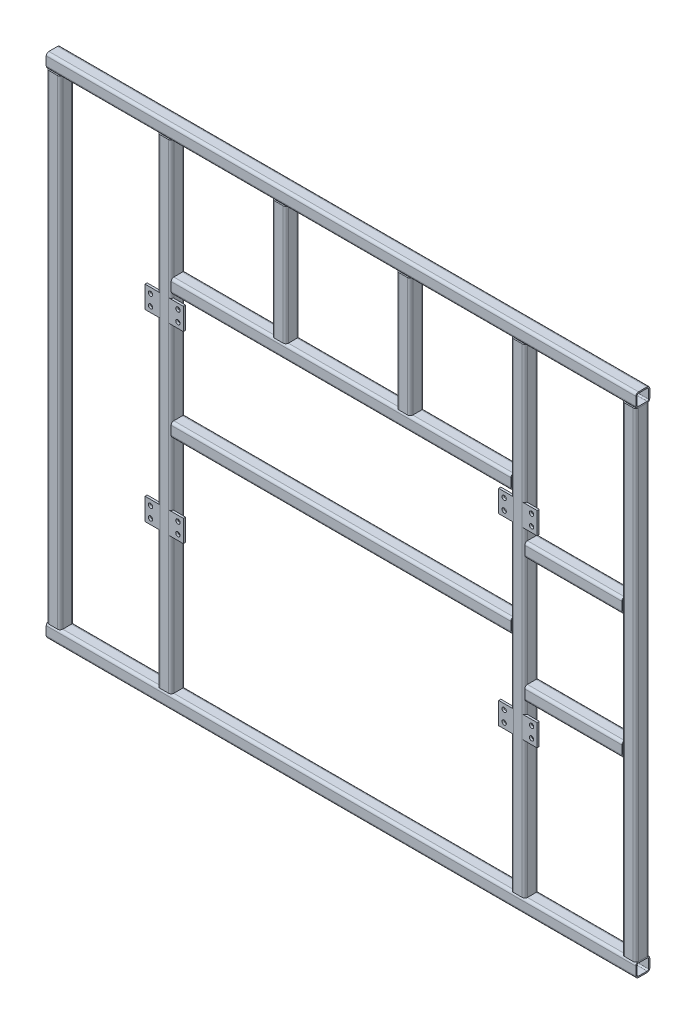
from build123d import *

# Parameters (mm, degrees)
RURA_CIENKO_CIENNA_KWADRATOWA_TS2X2X0_18_DEPTH      = 2125.4
RURA_CIENKO_CIENNA_KWADRATOWA_TS2X2X0_18_DEPTH_BACK = 25.4
RURA_CIENKO_CIENNA_KWADRATOWA_TS2X2X_2_DEPTH        = 2150.8
RURA_CIENKO_CIENNA_KWADRATOWA_TS2X2X_3_DEPTH        = 1292
RURA_CIENKO_CIENNA_KWADRATOWA_TS2X2X_5_DEPTH        = 1292
RURA_CIENKO_CIENNA_KWADRATOWA_TS2X2X_7_DEPTH        = 1802
RURA_CIENKO_CIENNA_KWADRATOWA_TS2X2X_9_DEPTH        = 1802
RURA_CIENKO_CIENNA_KWADRATOWA_TS2X2X_11_DEPTH       = 1802
RURA_CIENKO_CIENNA_KWADRATOWA_TS2X2X_14_DEPTH       = 1802
RURA_CIENKO_CIENNA_KWADRATOWA_TS2X2X_17_DEPTH       = 487
RURA_CIENKO_CIENNA_KWADRATOWA_TS2X2X_20_DEPTH       = 487
RURA_CIENKO_CIENNA_KWADRATOWA_TS2X2X_23_DEPTH       = 407
RURA_CIENKO_CIENNA_KWADRATOWA_TS2X2X_26_DEPTH       = 407
SZKIC16_W                                           = 140
SZKIC16_H                                           = 80
SZKIC16_R                                           = 8
DODANIE_WYCI_GNI_CIE1_DEPTH                         = 8
SZYK_LINIOWY1_COUNT                                 = 2
SZYK_LINIOWY1_PITCH                                 = 1290
SZYK_LINIOWY1_COUNT_DIR2                            = 2
SZYK_LINIOWY1_PITCH_DIR2                            = 670


with BuildPart() as part:
    # Sketch1 → Rura cienkościenna kwadratowa TS2X2X0.1875(1) (new, two sides: drawn at the far end of the back side and taken through both)
    with BuildSketch(Plane(origin=(0, 0, 0), x_dir=(0, 0, 1), z_dir=(1, 0, 0)).offset(-RURA_CIENKO_CIENNA_KWADRATOWA_TS2X2X0_18_DEPTH_BACK)):
        with BuildLine():
            Line((-15.875, -25.4), (15.875, -25.4))
            ThreePointArc((15.875, -25.4), (22.610192091, -22.610192091), (25.4, -15.875))
            Line((25.4, -15.875), (25.4, 15.875))
            ThreePointArc((25.4, 15.875), (22.610192091, 22.610192091), (15.875, 25.4))
            Line((15.875, 25.4), (-15.875, 25.4))
            ThreePointArc((-15.875, 25.4), (-22.610192091, 22.610192091), (-25.4, 15.875))
            Line((-25.4, 15.875), (-25.4, -15.875))
            ThreePointArc((-25.4, -15.875), (-22.610192091, -22.610192091), (-15.875, -25.4))
        make_face()
        with BuildLine():
            Line((-15.875, -20.6375), (15.875, -20.6375))
            ThreePointArc((15.875, -20.6375), (19.242596045, -19.242596045), (20.6375, -15.875))
            Line((20.6375, -15.875), (20.6375, 15.875))
            ThreePointArc((20.6375, 15.875), (19.242596045, 19.242596045), (15.875, 20.6375))
            Line((15.875, 20.6375), (-15.875, 20.6375))
            ThreePointArc((-15.875, 20.6375), (-19.242596045, 19.242596045), (-20.6375, 15.875))
            Line((-20.6375, 15.875), (-20.6375, -15.875))
            ThreePointArc((-20.6375, -15.875), (-19.242596045, -19.242596045), (-15.875, -20.6375))
        make_face(mode=Mode.SUBTRACT)
    extrude(amount=RURA_CIENKO_CIENNA_KWADRATOWA_TS2X2X0_18_DEPTH + RURA_CIENKO_CIENNA_KWADRATOWA_TS2X2X0_18_DEPTH_BACK)


with BuildPart() as body_2:
    # Sketch1 on segment 2 (carried to segment 2) → Rura cienko_cienna kwadratowa TS2X2X 2 (new body)
    with BuildSketch(Plane(origin=(-25.4, 1800, 0), x_dir=(0, 0, 1), z_dir=(1, 0, 0))):
        with BuildLine():
            Line((-15.875, -25.4), (15.875, -25.4))
            ThreePointArc((15.875, -25.4), (22.610192091, -22.610192091), (25.4, -15.875))
            Line((25.4, -15.875), (25.4, 15.875))
            ThreePointArc((25.4, 15.875), (22.610192091, 22.610192091), (15.875, 25.4))
            Line((15.875, 25.4), (-15.875, 25.4))
            ThreePointArc((-15.875, 25.4), (-22.610192091, 22.610192091), (-25.4, 15.875))
            Line((-25.4, 15.875), (-25.4, -15.875))
            ThreePointArc((-25.4, -15.875), (-22.610192091, -22.610192091), (-15.875, -25.4))
        make_face()
        with BuildLine():
            Line((-15.875, -20.6375), (15.875, -20.6375))
            ThreePointArc((15.875, -20.6375), (19.242596045, -19.242596045), (20.6375, -15.875))
            Line((20.6375, -15.875), (20.6375, 15.875))
            ThreePointArc((20.6375, 15.875), (19.242596045, 19.242596045), (15.875, 20.6375))
            Line((15.875, 20.6375), (-15.875, 20.6375))
            ThreePointArc((-15.875, 20.6375), (-19.242596045, 19.242596045), (-20.6375, 15.875))
            Line((-20.6375, 15.875), (-20.6375, -15.875))
            ThreePointArc((-20.6375, -15.875), (-19.242596045, -19.242596045), (-15.875, -20.6375))
        make_face(mode=Mode.SUBTRACT)
    extrude(amount=RURA_CIENKO_CIENNA_KWADRATOWA_TS2X2X_2_DEPTH)


with BuildPart() as body_3:
    # Sketch1 on segment 3 (carried to segment 3) → Rura cienko_cienna kwadratowa TS2X2X 3 (new body)
    with BuildSketch(Plane(origin=(404, 1315, 0), x_dir=(0, 0, 1), z_dir=(1, 0, 0))):
        with BuildLine():
            Line((-15.875, -25.4), (15.875, -25.4))
            ThreePointArc((15.875, -25.4), (22.610192091, -22.610192091), (25.4, -15.875))
            Line((25.4, -15.875), (25.4, 15.875))
            ThreePointArc((25.4, 15.875), (22.610192091, 22.610192091), (15.875, 25.4))
            Line((15.875, 25.4), (-15.875, 25.4))
            ThreePointArc((-15.875, 25.4), (-22.610192091, 22.610192091), (-25.4, 15.875))
            Line((-25.4, 15.875), (-25.4, -15.875))
            ThreePointArc((-25.4, -15.875), (-22.610192091, -22.610192091), (-15.875, -25.4))
        make_face()
        with BuildLine():
            Line((-15.875, -20.6375), (15.875, -20.6375))
            ThreePointArc((15.875, -20.6375), (19.242596045, -19.242596045), (20.6375, -15.875))
            Line((20.6375, -15.875), (20.6375, 15.875))
            ThreePointArc((20.6375, 15.875), (19.242596045, 19.242596045), (15.875, 20.6375))
            Line((15.875, 20.6375), (-15.875, 20.6375))
            ThreePointArc((-15.875, 20.6375), (-19.242596045, 19.242596045), (-20.6375, 15.875))
            Line((-20.6375, 15.875), (-20.6375, -15.875))
            ThreePointArc((-20.6375, -15.875), (-19.242596045, -19.242596045), (-15.875, -20.6375))
        make_face(mode=Mode.SUBTRACT)
    extrude(amount=RURA_CIENKO_CIENNA_KWADRATOWA_TS2X2X_3_DEPTH)

    # Rura cienko_cienna kwadratowa TS2X2X 3 e
    split(bisect_by=Plane(origin=(430.4, 1315, 0), x_dir=(0, 1, 0), z_dir=(1, 0, 0)), keep=Keep.TOP)

    # Rura cienko_cienna kwadratowa TS2X2X 4
    split(bisect_by=Plane(origin=(1669.6, 1315, 0), x_dir=(0, -1, 0), z_dir=(-1, 0, 0)), keep=Keep.TOP)


with BuildPart() as body_4:
    # Sketch1 on segment 4 (carried to segment 4) → Rura cienko_cienna kwadratowa TS2X2X 5 (new body)
    with BuildSketch(Plane(origin=(404, 861, 0), x_dir=(0, 0, 1), z_dir=(1, 0, 0))):
        with BuildLine():
            Line((-15.875, -25.4), (15.875, -25.4))
            ThreePointArc((15.875, -25.4), (22.610192091, -22.610192091), (25.4, -15.875))
            Line((25.4, -15.875), (25.4, 15.875))
            ThreePointArc((25.4, 15.875), (22.610192091, 22.610192091), (15.875, 25.4))
            Line((15.875, 25.4), (-15.875, 25.4))
            ThreePointArc((-15.875, 25.4), (-22.610192091, 22.610192091), (-25.4, 15.875))
            Line((-25.4, 15.875), (-25.4, -15.875))
            ThreePointArc((-25.4, -15.875), (-22.610192091, -22.610192091), (-15.875, -25.4))
        make_face()
        with BuildLine():
            Line((-15.875, -20.6375), (15.875, -20.6375))
            ThreePointArc((15.875, -20.6375), (19.242596045, -19.242596045), (20.6375, -15.875))
            Line((20.6375, -15.875), (20.6375, 15.875))
            ThreePointArc((20.6375, 15.875), (19.242596045, 19.242596045), (15.875, 20.6375))
            Line((15.875, 20.6375), (-15.875, 20.6375))
            ThreePointArc((-15.875, 20.6375), (-19.242596045, 19.242596045), (-20.6375, 15.875))
            Line((-20.6375, 15.875), (-20.6375, -15.875))
            ThreePointArc((-20.6375, -15.875), (-19.242596045, -19.242596045), (-15.875, -20.6375))
        make_face(mode=Mode.SUBTRACT)
    extrude(amount=RURA_CIENKO_CIENNA_KWADRATOWA_TS2X2X_5_DEPTH)

    # Rura cienko_cienna kwadratowa TS2X2X 5 e
    split(bisect_by=Plane(origin=(430.4, 861, 0), x_dir=(0, 1, 0), z_dir=(1, 0, 0)), keep=Keep.TOP)

    # Rura cienko_cienna kwadratowa TS2X2X 6
    split(bisect_by=Plane(origin=(1669.6, 861, 0), x_dir=(0, -1, 0), z_dir=(-1, 0, 0)), keep=Keep.TOP)


with BuildPart() as body_5:
    # Sketch1 on segment 5 (carried to segment 5) → Rura cienko_cienna kwadratowa TS2X2X 7 (new body)
    with BuildSketch(Plane.ZX.offset(-1)):
        with BuildLine():
            Line((-15.875, -25.4), (15.875, -25.4))
            ThreePointArc((15.875, -25.4), (22.610192091, -22.610192091), (25.4, -15.875))
            Line((25.4, -15.875), (25.4, 15.875))
            ThreePointArc((25.4, 15.875), (22.610192091, 22.610192091), (15.875, 25.4))
            Line((15.875, 25.4), (-15.875, 25.4))
            ThreePointArc((-15.875, 25.4), (-22.610192091, 22.610192091), (-25.4, 15.875))
            Line((-25.4, 15.875), (-25.4, -15.875))
            ThreePointArc((-25.4, -15.875), (-22.610192091, -22.610192091), (-15.875, -25.4))
        make_face()
        with BuildLine():
            Line((-15.875, -20.6375), (15.875, -20.6375))
            ThreePointArc((15.875, -20.6375), (19.242596045, -19.242596045), (20.6375, -15.875))
            Line((20.6375, -15.875), (20.6375, 15.875))
            ThreePointArc((20.6375, 15.875), (19.242596045, 19.242596045), (15.875, 20.6375))
            Line((15.875, 20.6375), (-15.875, 20.6375))
            ThreePointArc((-15.875, 20.6375), (-19.242596045, 19.242596045), (-20.6375, 15.875))
            Line((-20.6375, 15.875), (-20.6375, -15.875))
            ThreePointArc((-20.6375, -15.875), (-19.242596045, -19.242596045), (-15.875, -20.6375))
        make_face(mode=Mode.SUBTRACT)
    extrude(amount=RURA_CIENKO_CIENNA_KWADRATOWA_TS2X2X_7_DEPTH)

    # Rura cienko_cienna kwadratowa TS2X2X 7 e
    split(bisect_by=Plane(origin=(0, 25.4, 0), x_dir=(-1, 0, 0), z_dir=(0, 1, 0)), keep=Keep.TOP)

    # Rura cienko_cienna kwadratowa TS2X2X 8
    split(bisect_by=Plane.XZ.offset(-1774.6), keep=Keep.TOP)


with BuildPart() as body_6:
    # Sketch1 on segment 6 (carried to segment 6) → Rura cienko_cienna kwadratowa TS2X2X 9 (new body)
    with BuildSketch(Plane(origin=(405, 1801, 0), x_dir=(0, 0, 1), z_dir=(0, -1, 0))):
        with BuildLine():
            Line((-15.875, -25.4), (15.875, -25.4))
            ThreePointArc((15.875, -25.4), (22.610192091, -22.610192091), (25.4, -15.875))
            Line((25.4, -15.875), (25.4, 15.875))
            ThreePointArc((25.4, 15.875), (22.610192091, 22.610192091), (15.875, 25.4))
            Line((15.875, 25.4), (-15.875, 25.4))
            ThreePointArc((-15.875, 25.4), (-22.610192091, 22.610192091), (-25.4, 15.875))
            Line((-25.4, 15.875), (-25.4, -15.875))
            ThreePointArc((-25.4, -15.875), (-22.610192091, -22.610192091), (-15.875, -25.4))
        make_face()
        with BuildLine():
            Line((-15.875, -20.6375), (15.875, -20.6375))
            ThreePointArc((15.875, -20.6375), (19.242596045, -19.242596045), (20.6375, -15.875))
            Line((20.6375, -15.875), (20.6375, 15.875))
            ThreePointArc((20.6375, 15.875), (19.242596045, 19.242596045), (15.875, 20.6375))
            Line((15.875, 20.6375), (-15.875, 20.6375))
            ThreePointArc((-15.875, 20.6375), (-19.242596045, 19.242596045), (-20.6375, 15.875))
            Line((-20.6375, 15.875), (-20.6375, -15.875))
            ThreePointArc((-20.6375, -15.875), (-19.242596045, -19.242596045), (-15.875, -20.6375))
        make_face(mode=Mode.SUBTRACT)
    extrude(amount=RURA_CIENKO_CIENNA_KWADRATOWA_TS2X2X_9_DEPTH)

    # Rura cienko_cienna kwadratowa TS2X2X 9 e
    split(bisect_by=Plane(origin=(405, 1774.6, 0), x_dir=(1, 0, 0), z_dir=(0, -1, 0)), keep=Keep.TOP)

    # Rura cienko_cienna kwadratowa TS2X2X 10
    split(bisect_by=Plane(origin=(405, 25.4, 0), x_dir=(-1, 0, 0), z_dir=(0, 1, 0)), keep=Keep.TOP)


with BuildPart() as body_7:
    # Sketch1 on segment 7 (carried to segment 7) → Rura cienko_cienna kwadratowa TS2X2X 11 (new body)
    with BuildSketch(Plane(origin=(1695, 1801, 0), x_dir=(0, 0, 1), z_dir=(0, -1, 0))):
        with BuildLine():
            Line((-15.875, -25.4), (15.875, -25.4))
            ThreePointArc((15.875, -25.4), (22.610192091, -22.610192091), (25.4, -15.875))
            Line((25.4, -15.875), (25.4, 15.875))
            ThreePointArc((25.4, 15.875), (22.610192091, 22.610192091), (15.875, 25.4))
            Line((15.875, 25.4), (-15.875, 25.4))
            ThreePointArc((-15.875, 25.4), (-22.610192091, 22.610192091), (-25.4, 15.875))
            Line((-25.4, 15.875), (-25.4, -15.875))
            ThreePointArc((-25.4, -15.875), (-22.610192091, -22.610192091), (-15.875, -25.4))
        make_face()
        with BuildLine():
            Line((-15.875, -20.6375), (15.875, -20.6375))
            ThreePointArc((15.875, -20.6375), (19.242596045, -19.242596045), (20.6375, -15.875))
            Line((20.6375, -15.875), (20.6375, 15.875))
            ThreePointArc((20.6375, 15.875), (19.242596045, 19.242596045), (15.875, 20.6375))
            Line((15.875, 20.6375), (-15.875, 20.6375))
            ThreePointArc((-15.875, 20.6375), (-19.242596045, 19.242596045), (-20.6375, 15.875))
            Line((-20.6375, 15.875), (-20.6375, -15.875))
            ThreePointArc((-20.6375, -15.875), (-19.242596045, -19.242596045), (-15.875, -20.6375))
        make_face(mode=Mode.SUBTRACT)
    extrude(amount=RURA_CIENKO_CIENNA_KWADRATOWA_TS2X2X_11_DEPTH)

    # Rura cienko_cienna kwadratowa TS2X2X 12
    split(bisect_by=Plane(origin=(1695, 1774.6, 0), x_dir=(1, 0, 0), z_dir=(0, -1, 0)), keep=Keep.TOP)

    # Rura cienko_cienna kwadratowa TS2X2X 13
    split(bisect_by=Plane(origin=(1695, 25.4, 0), x_dir=(-1, 0, 0), z_dir=(0, 1, 0)), keep=Keep.TOP)


with BuildPart() as body_8:
    # Sketch1 on segment 8 (carried to segment 8) → Rura cienko_cienna kwadratowa TS2X2X 14 (new body)
    with BuildSketch(Plane(origin=(2100, -1, 0), x_dir=(0, 0, 1), z_dir=(0, 1, 0))):
        with BuildLine():
            Line((-15.875, -25.4), (15.875, -25.4))
            ThreePointArc((15.875, -25.4), (22.610192091, -22.610192091), (25.4, -15.875))
            Line((25.4, -15.875), (25.4, 15.875))
            ThreePointArc((25.4, 15.875), (22.610192091, 22.610192091), (15.875, 25.4))
            Line((15.875, 25.4), (-15.875, 25.4))
            ThreePointArc((-15.875, 25.4), (-22.610192091, 22.610192091), (-25.4, 15.875))
            Line((-25.4, 15.875), (-25.4, -15.875))
            ThreePointArc((-25.4, -15.875), (-22.610192091, -22.610192091), (-15.875, -25.4))
        make_face()
        with BuildLine():
            Line((-15.875, -20.6375), (15.875, -20.6375))
            ThreePointArc((15.875, -20.6375), (19.242596045, -19.242596045), (20.6375, -15.875))
            Line((20.6375, -15.875), (20.6375, 15.875))
            ThreePointArc((20.6375, 15.875), (19.242596045, 19.242596045), (15.875, 20.6375))
            Line((15.875, 20.6375), (-15.875, 20.6375))
            ThreePointArc((-15.875, 20.6375), (-19.242596045, 19.242596045), (-20.6375, 15.875))
            Line((-20.6375, 15.875), (-20.6375, -15.875))
            ThreePointArc((-20.6375, -15.875), (-19.242596045, -19.242596045), (-15.875, -20.6375))
        make_face(mode=Mode.SUBTRACT)
    extrude(amount=RURA_CIENKO_CIENNA_KWADRATOWA_TS2X2X_14_DEPTH)

    # Rura cienko_cienna kwadratowa TS2X2X 15
    split(bisect_by=Plane(origin=(2100, 25.4, 0), x_dir=(-1, 0, 0), z_dir=(0, 1, 0)), keep=Keep.TOP)

    # Rura cienko_cienna kwadratowa TS2X2X 16
    split(bisect_by=Plane(origin=(2100, 1774.6, 0), x_dir=(1, 0, 0), z_dir=(0, -1, 0)), keep=Keep.TOP)


with BuildPart() as body_9:
    # Sketch1 on segment 9 (carried to segment 9) → Rura cienko_cienna kwadratowa TS2X2X 17 (new body)
    with BuildSketch(Plane(origin=(823, 1314, 0), x_dir=(-1, 0, 0), z_dir=(0, 1, 0))):
        with BuildLine():
            Line((-15.875, -25.4), (15.875, -25.4))
            ThreePointArc((15.875, -25.4), (22.610192091, -22.610192091), (25.4, -15.875))
            Line((25.4, -15.875), (25.4, 15.875))
            ThreePointArc((25.4, 15.875), (22.610192091, 22.610192091), (15.875, 25.4))
            Line((15.875, 25.4), (-15.875, 25.4))
            ThreePointArc((-15.875, 25.4), (-22.610192091, 22.610192091), (-25.4, 15.875))
            Line((-25.4, 15.875), (-25.4, -15.875))
            ThreePointArc((-25.4, -15.875), (-22.610192091, -22.610192091), (-15.875, -25.4))
        make_face()
        with BuildLine():
            Line((-15.875, -20.6375), (15.875, -20.6375))
            ThreePointArc((15.875, -20.6375), (19.242596045, -19.242596045), (20.6375, -15.875))
            Line((20.6375, -15.875), (20.6375, 15.875))
            ThreePointArc((20.6375, 15.875), (19.242596045, 19.242596045), (15.875, 20.6375))
            Line((15.875, 20.6375), (-15.875, 20.6375))
            ThreePointArc((-15.875, 20.6375), (-19.242596045, 19.242596045), (-20.6375, 15.875))
            Line((-20.6375, 15.875), (-20.6375, -15.875))
            ThreePointArc((-20.6375, -15.875), (-19.242596045, -19.242596045), (-15.875, -20.6375))
        make_face(mode=Mode.SUBTRACT)
    extrude(amount=RURA_CIENKO_CIENNA_KWADRATOWA_TS2X2X_17_DEPTH)

    # Rura cienko_cienna kwadratowa TS2X2X 18
    split(bisect_by=Plane(origin=(823, 1340.4, 0), x_dir=(-1, 0, 0), z_dir=(0, 1, 0)), keep=Keep.TOP)

    # Rura cienko_cienna kwadratowa TS2X2X 19
    split(bisect_by=Plane(origin=(823, 1774.6, 0), x_dir=(1, 0, 0), z_dir=(0, -1, 0)), keep=Keep.TOP)


with BuildPart() as body_10:
    # Sketch1 on segment 10 (carried to segment 10) → Rura cienko_cienna kwadratowa TS2X2X 20 (new body)
    with BuildSketch(Plane(origin=(1277, 1314, 0), x_dir=(-1, 0, 0), z_dir=(0, 1, 0))):
        with BuildLine():
            Line((-15.875, -25.4), (15.875, -25.4))
            ThreePointArc((15.875, -25.4), (22.610192091, -22.610192091), (25.4, -15.875))
            Line((25.4, -15.875), (25.4, 15.875))
            ThreePointArc((25.4, 15.875), (22.610192091, 22.610192091), (15.875, 25.4))
            Line((15.875, 25.4), (-15.875, 25.4))
            ThreePointArc((-15.875, 25.4), (-22.610192091, 22.610192091), (-25.4, 15.875))
            Line((-25.4, 15.875), (-25.4, -15.875))
            ThreePointArc((-25.4, -15.875), (-22.610192091, -22.610192091), (-15.875, -25.4))
        make_face()
        with BuildLine():
            Line((-15.875, -20.6375), (15.875, -20.6375))
            ThreePointArc((15.875, -20.6375), (19.242596045, -19.242596045), (20.6375, -15.875))
            Line((20.6375, -15.875), (20.6375, 15.875))
            ThreePointArc((20.6375, 15.875), (19.242596045, 19.242596045), (15.875, 20.6375))
            Line((15.875, 20.6375), (-15.875, 20.6375))
            ThreePointArc((-15.875, 20.6375), (-19.242596045, 19.242596045), (-20.6375, 15.875))
            Line((-20.6375, 15.875), (-20.6375, -15.875))
            ThreePointArc((-20.6375, -15.875), (-19.242596045, -19.242596045), (-15.875, -20.6375))
        make_face(mode=Mode.SUBTRACT)
    extrude(amount=RURA_CIENKO_CIENNA_KWADRATOWA_TS2X2X_20_DEPTH)

    # Rura cienko_cienna kwadratowa TS2X2X 21
    split(bisect_by=Plane(origin=(1277, 1340.4, 0), x_dir=(-1, 0, 0), z_dir=(0, 1, 0)), keep=Keep.TOP)

    # Rura cienko_cienna kwadratowa TS2X2X 22
    split(bisect_by=Plane(origin=(1277, 1774.6, 0), x_dir=(1, 0, 0), z_dir=(0, -1, 0)), keep=Keep.TOP)


with BuildPart() as body_11:
    # Sketch1 on segment 11 (carried to segment 11) → Rura cienko_cienna kwadratowa TS2X2X 23 (new body)
    with BuildSketch(Plane(origin=(1694, 1127, 0), x_dir=(0, 1, 0), z_dir=(1, 0, 0))):
        with BuildLine():
            Line((-15.875, -25.4), (15.875, -25.4))
            ThreePointArc((15.875, -25.4), (22.610192091, -22.610192091), (25.4, -15.875))
            Line((25.4, -15.875), (25.4, 15.875))
            ThreePointArc((25.4, 15.875), (22.610192091, 22.610192091), (15.875, 25.4))
            Line((15.875, 25.4), (-15.875, 25.4))
            ThreePointArc((-15.875, 25.4), (-22.610192091, 22.610192091), (-25.4, 15.875))
            Line((-25.4, 15.875), (-25.4, -15.875))
            ThreePointArc((-25.4, -15.875), (-22.610192091, -22.610192091), (-15.875, -25.4))
        make_face()
        with BuildLine():
            Line((-15.875, -20.6375), (15.875, -20.6375))
            ThreePointArc((15.875, -20.6375), (19.242596045, -19.242596045), (20.6375, -15.875))
            Line((20.6375, -15.875), (20.6375, 15.875))
            ThreePointArc((20.6375, 15.875), (19.242596045, 19.242596045), (15.875, 20.6375))
            Line((15.875, 20.6375), (-15.875, 20.6375))
            ThreePointArc((-15.875, 20.6375), (-19.242596045, 19.242596045), (-20.6375, 15.875))
            Line((-20.6375, 15.875), (-20.6375, -15.875))
            ThreePointArc((-20.6375, -15.875), (-19.242596045, -19.242596045), (-15.875, -20.6375))
        make_face(mode=Mode.SUBTRACT)
    extrude(amount=RURA_CIENKO_CIENNA_KWADRATOWA_TS2X2X_23_DEPTH)

    # Rura cienko_cienna kwadratowa TS2X2X 24
    split(bisect_by=Plane(origin=(1720.4, 1127, 0), x_dir=(0, 1, 0), z_dir=(1, 0, 0)), keep=Keep.TOP)

    # Rura cienko_cienna kwadratowa TS2X2X 25
    split(bisect_by=Plane(origin=(2074.6, 1127, 0), x_dir=(0, -1, 0), z_dir=(-1, 0, 0)), keep=Keep.TOP)


with BuildPart() as body_12:
    # Sketch1 on segment 12 (carried to segment 12) → Rura cienko_cienna kwadratowa TS2X2X 26 (new body)
    with BuildSketch(Plane(origin=(1694, 673, 0), x_dir=(0, 1, 0), z_dir=(1, 0, 0))):
        with BuildLine():
            Line((-15.875, -25.4), (15.875, -25.4))
            ThreePointArc((15.875, -25.4), (22.610192091, -22.610192091), (25.4, -15.875))
            Line((25.4, -15.875), (25.4, 15.875))
            ThreePointArc((25.4, 15.875), (22.610192091, 22.610192091), (15.875, 25.4))
            Line((15.875, 25.4), (-15.875, 25.4))
            ThreePointArc((-15.875, 25.4), (-22.610192091, 22.610192091), (-25.4, 15.875))
            Line((-25.4, 15.875), (-25.4, -15.875))
            ThreePointArc((-25.4, -15.875), (-22.610192091, -22.610192091), (-15.875, -25.4))
        make_face()
        with BuildLine():
            Line((-15.875, -20.6375), (15.875, -20.6375))
            ThreePointArc((15.875, -20.6375), (19.242596045, -19.242596045), (20.6375, -15.875))
            Line((20.6375, -15.875), (20.6375, 15.875))
            ThreePointArc((20.6375, 15.875), (19.242596045, 19.242596045), (15.875, 20.6375))
            Line((15.875, 20.6375), (-15.875, 20.6375))
            ThreePointArc((-15.875, 20.6375), (-19.242596045, 19.242596045), (-20.6375, 15.875))
            Line((-20.6375, 15.875), (-20.6375, -15.875))
            ThreePointArc((-20.6375, -15.875), (-19.242596045, -19.242596045), (-15.875, -20.6375))
        make_face(mode=Mode.SUBTRACT)
    extrude(amount=RURA_CIENKO_CIENNA_KWADRATOWA_TS2X2X_26_DEPTH)

    # Rura cienko_cienna kwadratowa TS2X2X 27
    split(bisect_by=Plane(origin=(1720.4, 673, 0), x_dir=(0, 1, 0), z_dir=(1, 0, 0)), keep=Keep.TOP)

    # Rura cienko_cienna kwadratowa TS2X2X 28
    split(bisect_by=Plane(origin=(2074.6, 673, 0), x_dir=(0, -1, 0), z_dir=(-1, 0, 0)), keep=Keep.TOP)


with BuildPart() as body_13:
    # Szkic16 → Dodanie-wyciągnięcie1 (new body)
    with BuildSketch(Plane.XY.offset(25.4)):
        with Locations((405, 1235)):
            Rectangle(SZKIC16_W, SZKIC16_H)
        with Locations((455, 1255)):
            Circle(SZKIC16_R, mode=Mode.SUBTRACT)
        with Locations((455, 1215)):
            Circle(SZKIC16_R, mode=Mode.SUBTRACT)
        with Locations((355, 1215)):
            Circle(SZKIC16_R, mode=Mode.SUBTRACT)
        with Locations((355, 1255)):
            Circle(SZKIC16_R, mode=Mode.SUBTRACT)
    dodanie_wyci_gni_cie1 = extrude(amount=-DODANIE_WYCI_GNI_CIE1_DEPTH)


with BuildPart() as szyk_liniowy1_1:
    # Szyk liniowy1: Dodanie-wyci_gni_cie1 2 × 2
    with Locations(*[(i * SZYK_LINIOWY1_PITCH, -j * SZYK_LINIOWY1_PITCH_DIR2, 0) for i in range(SZYK_LINIOWY1_COUNT) for j in range(SZYK_LINIOWY1_COUNT_DIR2) if (i, j) != (0, 0)]):
        add(dodanie_wyci_gni_cie1)


solid = Compound([part.part, body_2.part, body_3.part, body_4.part, body_5.part, body_6.part, body_7.part, body_8.part, body_9.part, body_10.part, body_11.part, body_12.part, body_13.part, szyk_liniowy1_1.part])
